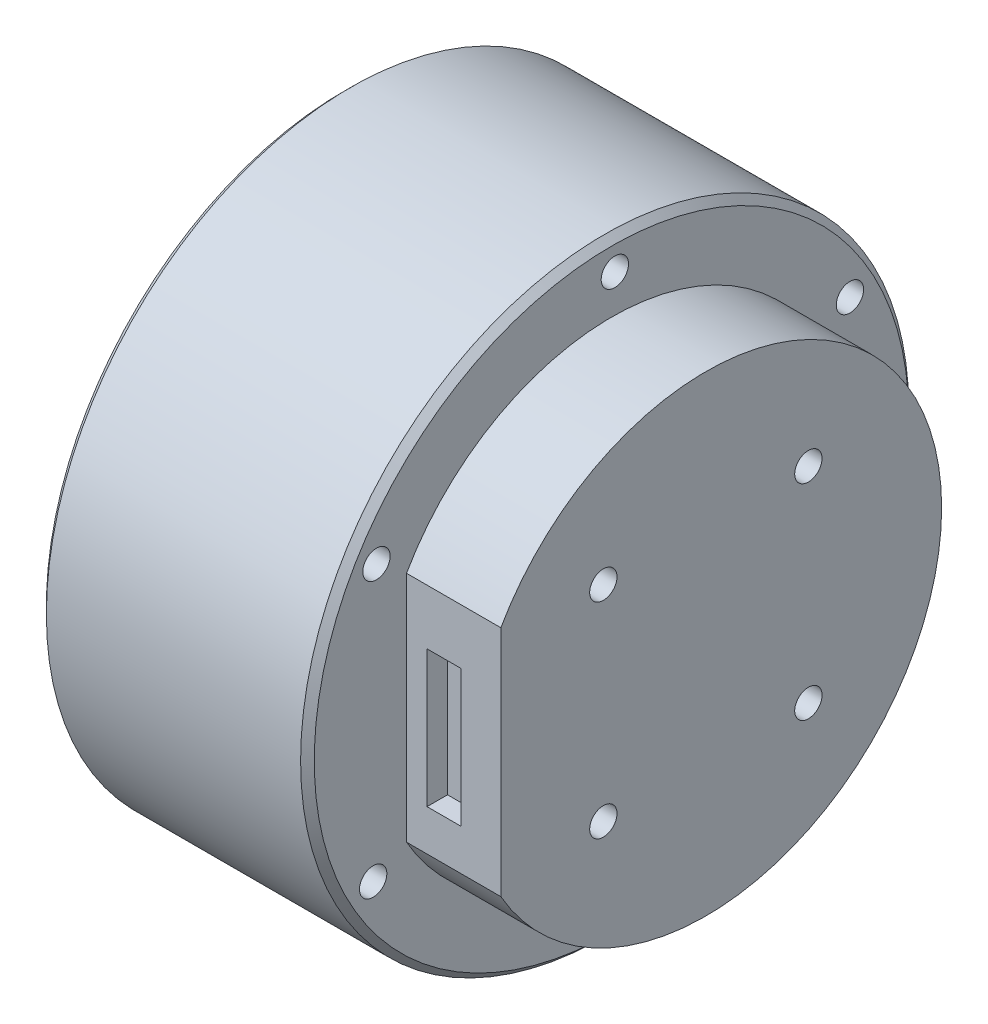
from build123d import *

# Parameters (mm, degrees)
SKETCH_1_R          = 44.5
EXTRUDE_1_DEPTH     = 39.2
EXTRUDE_3_DEPTH     = 13.8
SKETCH_4_R          = 2
CUT_EXTRUDE_1_DEPTH = 13.8
SKETCH_5_R          = 2
CUT_EXTRUDE_2_DEPTH = 10
CHAMFER_1_SIZE      = 1
SKETCH_6_R          = 2.5
CUT_EXTRUDE_3_DEPTH = 5
SKETCH_7_W          = 5
SKETCH_7_H          = 20
CUT_EXTRUDE_4_DEPTH = 3
SKETCH_8_R          = 8.75
CUT_EXTRUDE_5_DEPTH = 17


with BuildPart() as part:
    # 草图1 → 凸台-拉伸1 (new body)
    with BuildSketch(Plane(origin=(0, 0, 0), x_dir=(0, 0, -1), z_dir=(1, 0, 0))):
        Circle(SKETCH_1_R)
    extrude(amount=EXTRUDE_1_DEPTH)

    # 草图2 → 凸台-拉伸3 (add)
    with BuildSketch(Plane(origin=(39.2, 0, 0), x_dir=(0, 0, -1), z_dir=(1, 0, 0))):
        with BuildLine():
            Line((-30, 17.036725037), (-30, -17.036725037))
            ThreePointArc((-30, -17.036725037), (34.5, 0), (-30, 17.036725037))
        make_face()
    extrude(amount=EXTRUDE_3_DEPTH)

    # 草图4 → 切除-拉伸1 (cut)
    with BuildSketch(Plane(origin=(39.2, 0, 0), x_dir=(0, 0, -1), z_dir=(1, 0, 0))):
        with Locations((0.484323727, 39.997067774)):
            Circle(SKETCH_4_R)
        with Locations((34.880638633, 19.579097236)):
            Circle(SKETCH_4_R)
        with Locations((34.396314906, -20.417970538)):
            Circle(SKETCH_4_R)
        with Locations((-0.484323727, -39.997067774)):
            Circle(SKETCH_4_R)
        with Locations((-34.880638633, -19.579097236)):
            Circle(SKETCH_4_R)
        with Locations((-34.396314906, 20.417970538)):
            Circle(SKETCH_4_R)
    extrude(amount=-CUT_EXTRUDE_1_DEPTH, mode=Mode.SUBTRACT)

    # 草图5 → 切除-拉伸2 (cut)
    with BuildSketch(Plane(origin=(53, 0, 0), x_dir=(0, 0, -1), z_dir=(1, 0, 0))):
        with Locations((-15, 15)):
            Circle(SKETCH_5_R)
        with Locations((15, 15)):
            Circle(SKETCH_5_R)
        with Locations((15, -15)):
            Circle(SKETCH_5_R)
        with Locations((-15, -15)):
            Circle(SKETCH_5_R)
    extrude(amount=-CUT_EXTRUDE_2_DEPTH, mode=Mode.SUBTRACT)

    # 倒角1
    chamfer_1_edges = [part.edges().sort_by_distance(p)[0] for p in [
        (0, 0, 44.5),
        (39.2, 0, 44.5),
    ]]
    chamfer(chamfer_1_edges, length=CHAMFER_1_SIZE)

    # 草图6 → 切除-拉伸3 (cut)
    with BuildSketch(Plane.ZY):
        with Locations((0, 22)):
            Circle(SKETCH_6_R)
        with Locations((-12.374368671, 12.374368671)):
            Circle(SKETCH_6_R)
        with Locations((22, 0)):
            Circle(SKETCH_6_R)
        with Locations((12.374368671, 12.374368671)):
            Circle(SKETCH_6_R)
        with Locations((0, -22)):
            Circle(SKETCH_6_R)
        with Locations((12.374368671, -12.374368671)):
            Circle(SKETCH_6_R)
        with Locations((-22, 0)):
            Circle(SKETCH_6_R)
        with Locations((-12.374368671, -12.374368671)):
            Circle(SKETCH_6_R)
    extrude(amount=-CUT_EXTRUDE_3_DEPTH, mode=Mode.SUBTRACT)

    # 草图7 → 切除-拉伸4 (cut)
    with BuildSketch(Plane.XY.offset(30)):
        with Locations((44.7, -1.036725037)):
            Rectangle(SKETCH_7_W, SKETCH_7_H)
    extrude(amount=-CUT_EXTRUDE_4_DEPTH, mode=Mode.SUBTRACT)

    # 草图8 → 切除-拉伸5 (cut)
    with BuildSketch(Plane.ZY):
        Circle(SKETCH_8_R)
    extrude(amount=-CUT_EXTRUDE_5_DEPTH, mode=Mode.SUBTRACT)


solid = part.part
